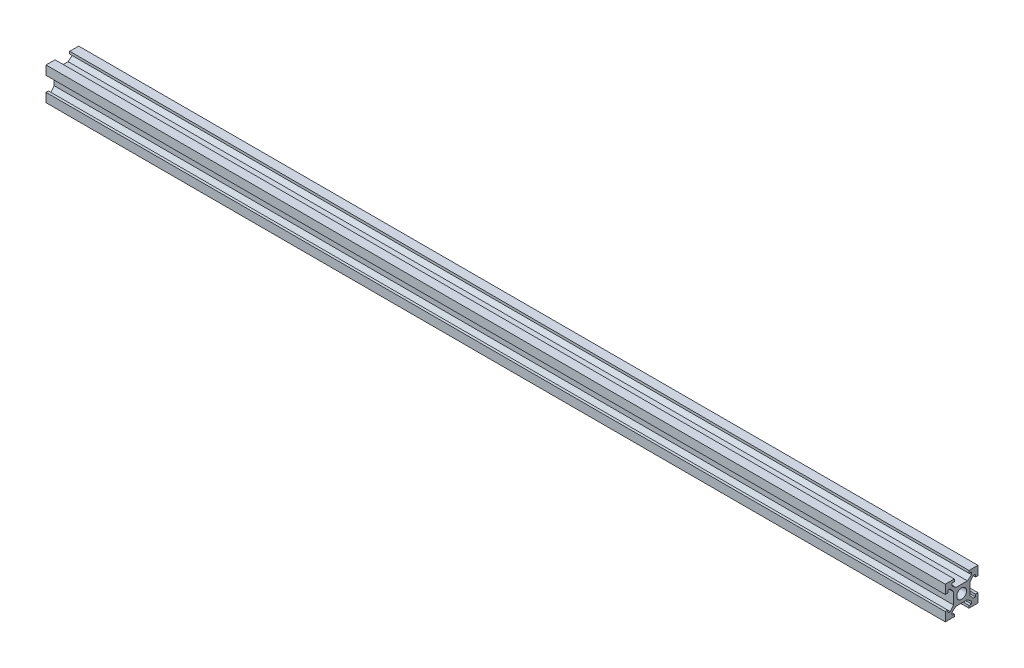
from build123d import *

# Parameters (mm, degrees)
SKETCH1_W           = 20
SKETCH1_H           = 20
BOSS_EXTRUDE1_DEPTH = 550
SKETCH2_R           = 3
CUT_EXTRUDE1_DEPTH  = 551.181788139
CUT_EXTRUDE2_DEPTH  = 551.181788139
CIRPATTERN1_COUNT   = 4


with BuildPart() as part:
    # Sketch1 → Boss-Extrude1 (new body)
    with BuildSketch(Plane(origin=(0, 0, 0), x_dir=(0, 0, -1), z_dir=(1, 0, 0))):
        Rectangle(SKETCH1_W, SKETCH1_H)
    extrude(amount=BOSS_EXTRUDE1_DEPTH)

    # Sketch2 → Cut-Extrude1 (cut, through all)
    with BuildSketch(Plane(origin=(550, 0, 0), x_dir=(0, 0, -1), z_dir=(1, 0, 0))):
        Circle(SKETCH2_R)
    extrude(amount=-CUT_EXTRUDE1_DEPTH, mode=Mode.SUBTRACT)

    # Sketch2<3> → Cut-Extrude2 (cut, through all)
    with BuildSketch(Plane(origin=(550, 0, 0), x_dir=(0, 0, -1), z_dir=(1, 0, 0))):
        Polygon((-3.5, 5), (3.5, 5), (6, 7), (6, 8.5), (4.5, 8.5), (4.5, 10), (-4.5, 10), (-4.5, 8.5), (-6, 8.5), (-6, 7), align=None)
    cut_extrude2 = extrude(amount=-CUT_EXTRUDE2_DEPTH, mode=Mode.SUBTRACT)

    # CirPattern1: Cut-Extrude2 ×4 about axis
    cirpattern1_axis = Axis((0, 0, 0), (1, 0, 0))
    for i in range(1, CIRPATTERN1_COUNT):
        add(cut_extrude2.rotate(cirpattern1_axis, i * 360 / CIRPATTERN1_COUNT), mode=Mode.SUBTRACT)


solid = part.part
